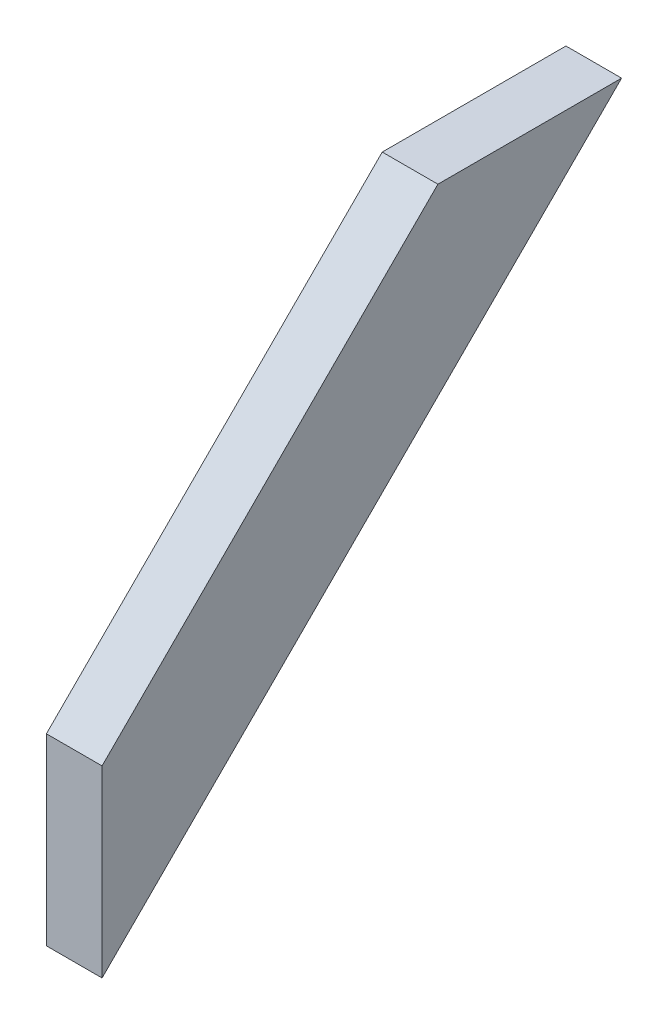
from build123d import *

# Parameters (mm, degrees)
BOSS_EXTRUDE1_DEPTH = 38.1


with BuildPart() as part:
    # Sketch1 → Boss-Extrude1 (new body)
    with BuildSketch(Plane(origin=(0, 0, 0), x_dir=(0, 0, -1), z_dir=(1, 0, 0))):
        Polygon((0, 0), (0, 125.723585695), (229.876414305, 355.6), (355.6, 355.6), align=None)
    extrude(amount=BOSS_EXTRUDE1_DEPTH)


solid = part.part
